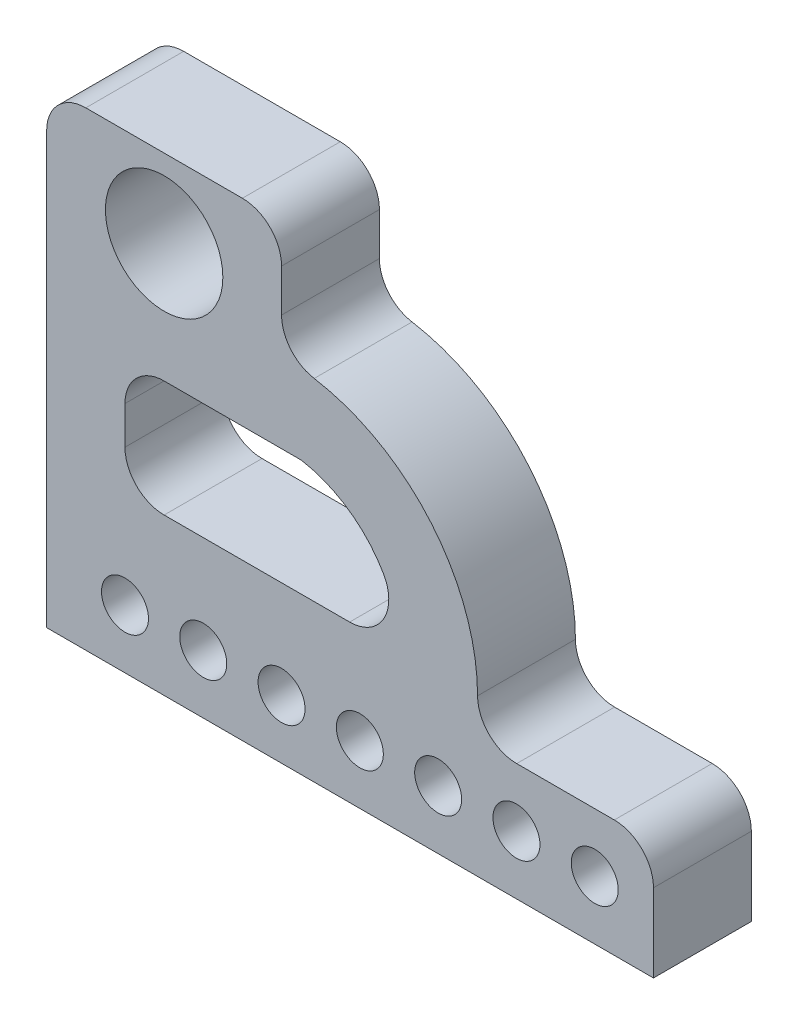
from build123d import *

# Parameters (mm, degrees)
SKETCH1_R           = 15
SKETCH1_R_2         = 6
BOSS_EXTRUDE1_DEPTH = 25


with BuildPart() as part:
    # Sketch1 → Boss-Extrude1 (new body)
    with BuildSketch(Plane.XY):
        with BuildLine():
            Line((40.063427207, -29.949425047), (64.999534256, -29.955194996))
            ThreePointArc((64.999534256, -29.955194996), (72.069106212, -32.884945049), (74.997220362, -39.955194729))
            Line((74.997220362, -39.955194729), (74.997220362, -59.917750729))
            Line((74.997220362, -59.917750729), (-80.002779638, -59.917750729))
            Line((-80.002779638, -59.917750729), (-80.002779638, 50.082249271))
            ThreePointArc((-80.002779638, 50.082249271), (-77.073847449, 57.153317083), (-70.002779638, 60.082249271))
            Line((-70.002779638, 60.082249271), (-30.002779638, 60.082249271))
            ThreePointArc((-30.002779638, 60.082249271), (-22.931711826, 57.153317083), (-20.002779638, 50.082249271))
            Line((-20.002779638, 50.082249271), (-20.002779638, 39.24305603))
            ThreePointArc((-20.002779638, 39.24305603), (-17.640405796, 32.788083786), (-11.669446304, 29.382923058))
            ThreePointArc((-11.669446304, 29.382923058), (18.22116437, 12.344839461), (30.065744482, -19.957649933))
            ThreePointArc((30.065744482, -19.957649933), (32.996763354, -27.022582575), (40.063427207, -29.949425047))
        make_face()
        with Locations((-50, 40.082249271)):
            Circle(SKETCH1_R, mode=Mode.SUBTRACT)
        with Locations((-60.002779638, -44.917750729)):
            Circle(SKETCH1_R_2, mode=Mode.SUBTRACT)
        with Locations((-40.002779638, -44.917750729)):
            Circle(SKETCH1_R_2, mode=Mode.SUBTRACT)
        with Locations((-20.002779638, -44.917750729)):
            Circle(SKETCH1_R_2, mode=Mode.SUBTRACT)
        with Locations((-0.002779638, -44.917750729)):
            Circle(SKETCH1_R_2, mode=Mode.SUBTRACT)
        with Locations((19.997220362, -44.917750729)):
            Circle(SKETCH1_R_2, mode=Mode.SUBTRACT)
        with Locations((39.997220362, -44.917750729)):
            Circle(SKETCH1_R_2, mode=Mode.SUBTRACT)
        with Locations((59.997220362, -44.917750729)):
            Circle(SKETCH1_R_2, mode=Mode.SUBTRACT)
        with BuildLine():
            Line((-15.002779638, 9.662657115), (-50.002779638, 9.662657115))
            ThreePointArc((-50.002779638, 9.662657115), (-57.073847449, 6.733724927), (-60.002779638, -0.337342885))
            Line((-60.002779638, -0.337342885), (-60.002779638, -9.996302817))
            ThreePointArc((-60.002779638, -9.996302817), (-57.072540419, -17.068677418), (-49.999083138, -19.996302134))
            Line((-49.999083138, -19.996302134), (-2.608906127, -19.978784358))
            ThreePointArc((-2.608906127, -19.978784358), (6.045547234, -14.982427813), (6.053700131, -4.989276396))
            ThreePointArc((6.053700131, -4.989276396), (-2.834464117, 4.693663889), (-15.002779638, 9.662657115))
        make_face(mode=Mode.SUBTRACT)
    extrude(amount=BOSS_EXTRUDE1_DEPTH)


solid = part.part
